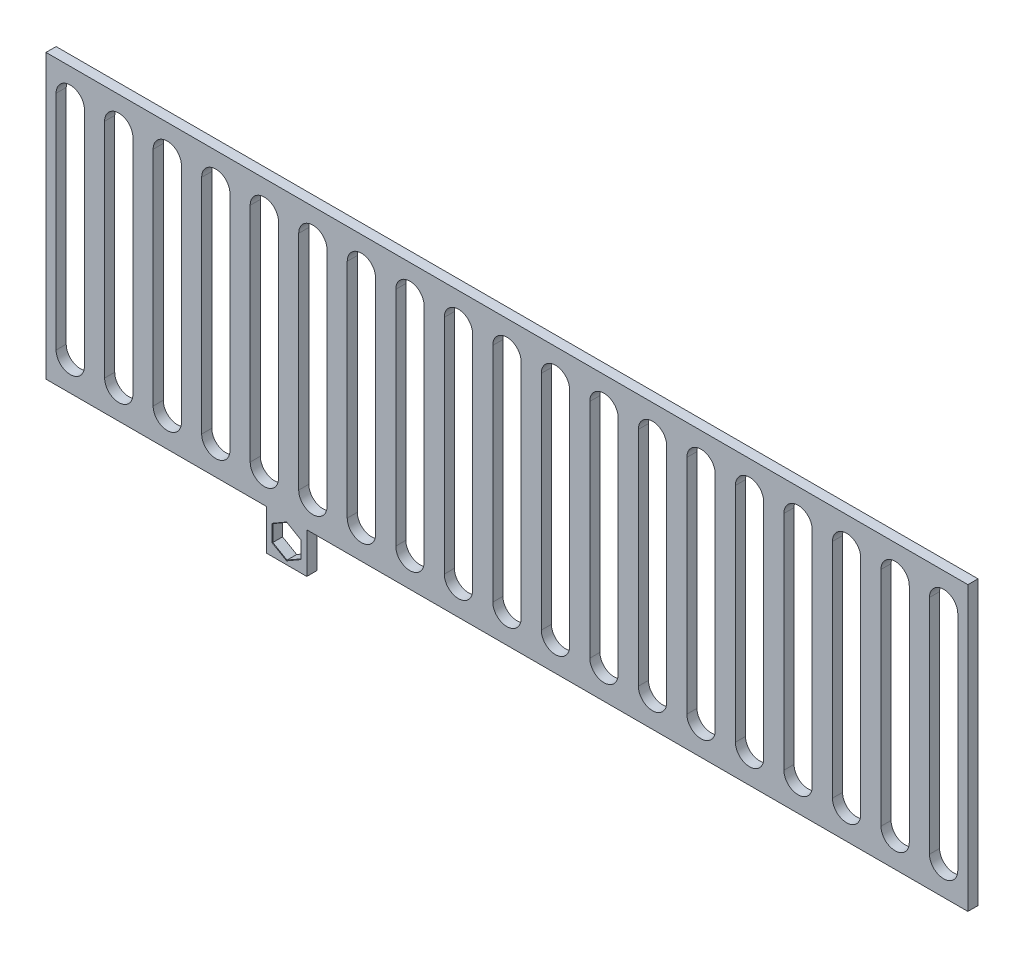
from build123d import *

# Parameters (mm, degrees)
BOSS_EXTRU_1_DEPTH = 2.5
CHANFREIN1_SIZE    = 0.1


with BuildPart() as part:
    # Esquisse1 → Boss.-Extru.1 (new body)
    with BuildSketch(Plane.XY):
        Polygon((-114, 35), (114, 35), (114, -35), (-49.5, -35), (-49.5, -45), (-59.5, -45), (-59.5, -35), (-114, -35), align=None)
        with BuildLine():
            Line((-111.5, -27.5), (-111.5, 27.5))
            ThreePointArc((-111.5, 27.5), (-108, 31), (-104.5, 27.5))
            Line((-104.5, 27.5), (-104.5, -27.5))
            ThreePointArc((-104.5, -27.5), (-108, -31), (-111.5, -27.5))
        make_face(mode=Mode.SUBTRACT)
        with BuildLine():
            Line((-92.5, -27.5), (-92.5, 27.5))
            ThreePointArc((-92.5, 27.5), (-96, 31), (-99.5, 27.5))
            Line((-99.5, 27.5), (-99.5, -27.5))
            ThreePointArc((-99.5, -27.5), (-96, -31), (-92.5, -27.5))
        make_face(mode=Mode.SUBTRACT)
        with BuildLine():
            Line((-80.5, -27.5), (-80.5, 27.5))
            ThreePointArc((-80.5, 27.5), (-84, 31), (-87.5, 27.5))
            Line((-87.5, 27.5), (-87.5, -27.5))
            ThreePointArc((-87.5, -27.5), (-84, -31), (-80.5, -27.5))
        make_face(mode=Mode.SUBTRACT)
        with BuildLine():
            Line((-68.5, -27.5), (-68.5, 27.5))
            ThreePointArc((-68.5, 27.5), (-72, 31), (-75.5, 27.5))
            Line((-75.5, 27.5), (-75.5, -27.5))
            ThreePointArc((-75.5, -27.5), (-72, -31), (-68.5, -27.5))
        make_face(mode=Mode.SUBTRACT)
        with BuildLine():
            Line((-56.5, -27.5), (-56.5, 27.5))
            ThreePointArc((-56.5, 27.5), (-60, 31), (-63.5, 27.5))
            Line((-63.5, 27.5), (-63.5, -27.5))
            ThreePointArc((-63.5, -27.5), (-60, -31), (-56.5, -27.5))
        make_face(mode=Mode.SUBTRACT)
        with BuildLine():
            Line((-44.5, -27.5), (-44.5, 27.5))
            ThreePointArc((-44.5, 27.5), (-48, 31), (-51.5, 27.5))
            Line((-51.5, 27.5), (-51.5, -27.5))
            ThreePointArc((-51.5, -27.5), (-48, -31), (-44.5, -27.5))
        make_face(mode=Mode.SUBTRACT)
        with BuildLine():
            Line((-32.5, -27.5), (-32.5, 27.5))
            ThreePointArc((-32.5, 27.5), (-36, 31), (-39.5, 27.5))
            Line((-39.5, 27.5), (-39.5, -27.5))
            ThreePointArc((-39.5, -27.5), (-36, -31), (-32.5, -27.5))
        make_face(mode=Mode.SUBTRACT)
        with BuildLine():
            Line((-20.5, -27.5), (-20.5, 27.5))
            ThreePointArc((-20.5, 27.5), (-24, 31), (-27.5, 27.5))
            Line((-27.5, 27.5), (-27.5, -27.5))
            ThreePointArc((-27.5, -27.5), (-24, -31), (-20.5, -27.5))
        make_face(mode=Mode.SUBTRACT)
        with BuildLine():
            Line((-8.5, -27.5), (-8.5, 27.5))
            ThreePointArc((-8.5, 27.5), (-12, 31), (-15.5, 27.5))
            Line((-15.5, 27.5), (-15.5, -27.5))
            ThreePointArc((-15.5, -27.5), (-12, -31), (-8.5, -27.5))
        make_face(mode=Mode.SUBTRACT)
        with BuildLine():
            Line((3.5, -27.5), (3.5, 27.5))
            ThreePointArc((3.5, 27.5), (0, 31), (-3.5, 27.5))
            Line((-3.5, 27.5), (-3.5, -27.5))
            ThreePointArc((-3.5, -27.5), (0, -31), (3.5, -27.5))
        make_face(mode=Mode.SUBTRACT)
        with BuildLine():
            Line((15.5, -27.5), (15.5, 27.5))
            ThreePointArc((15.5, 27.5), (12, 31), (8.5, 27.5))
            Line((8.5, 27.5), (8.5, -27.5))
            ThreePointArc((8.5, -27.5), (12, -31), (15.5, -27.5))
        make_face(mode=Mode.SUBTRACT)
        with BuildLine():
            Line((27.5, -27.5), (27.5, 27.5))
            ThreePointArc((27.5, 27.5), (24, 31), (20.5, 27.5))
            Line((20.5, 27.5), (20.5, -27.5))
            ThreePointArc((20.5, -27.5), (24, -31), (27.5, -27.5))
        make_face(mode=Mode.SUBTRACT)
        with BuildLine():
            Line((39.5, -27.5), (39.5, 27.5))
            ThreePointArc((39.5, 27.5), (36, 31), (32.5, 27.5))
            Line((32.5, 27.5), (32.5, -27.5))
            ThreePointArc((32.5, -27.5), (36, -31), (39.5, -27.5))
        make_face(mode=Mode.SUBTRACT)
        with BuildLine():
            Line((51.5, -27.5), (51.5, 27.5))
            ThreePointArc((51.5, 27.5), (48, 31), (44.5, 27.5))
            Line((44.5, 27.5), (44.5, -27.5))
            ThreePointArc((44.5, -27.5), (48, -31), (51.5, -27.5))
        make_face(mode=Mode.SUBTRACT)
        with BuildLine():
            Line((63.5, -27.5), (63.5, 27.5))
            ThreePointArc((63.5, 27.5), (60, 31), (56.5, 27.5))
            Line((56.5, 27.5), (56.5, -27.5))
            ThreePointArc((56.5, -27.5), (60, -31), (63.5, -27.5))
        make_face(mode=Mode.SUBTRACT)
        with BuildLine():
            Line((75.5, -27.5), (75.5, 27.5))
            ThreePointArc((75.5, 27.5), (72, 31), (68.5, 27.5))
            Line((68.5, 27.5), (68.5, -27.5))
            ThreePointArc((68.5, -27.5), (72, -31), (75.5, -27.5))
        make_face(mode=Mode.SUBTRACT)
        with BuildLine():
            Line((87.5, -27.5), (87.5, 27.5))
            ThreePointArc((87.5, 27.5), (84, 31), (80.5, 27.5))
            Line((80.5, 27.5), (80.5, -27.5))
            ThreePointArc((80.5, -27.5), (84, -31), (87.5, -27.5))
        make_face(mode=Mode.SUBTRACT)
        with BuildLine():
            Line((99.5, -27.5), (99.5, 27.5))
            ThreePointArc((99.5, 27.5), (96, 31), (92.5, 27.5))
            Line((92.5, 27.5), (92.5, -27.5))
            ThreePointArc((92.5, -27.5), (96, -31), (99.5, -27.5))
        make_face(mode=Mode.SUBTRACT)
        with BuildLine():
            Line((111.5, -27.5), (111.5, 27.5))
            ThreePointArc((111.5, 27.5), (108, 31), (104.5, 27.5))
            Line((104.5, 27.5), (104.5, -27.5))
            ThreePointArc((104.5, -27.5), (108, -31), (111.5, -27.5))
        make_face(mode=Mode.SUBTRACT)
        Polygon((-51, -42.020725942), (-51, -37.979274058), (-54.5, -35.958548116), (-58, -37.979274058), (-58, -42.020725942), (-54.5, -44.041451884), align=None, mode=Mode.SUBTRACT)
    extrude(amount=BOSS_EXTRU_1_DEPTH)

    # Chanfrein1
    chanfrein1_edges = [part.edges().sort_by_distance(p)[0] for p in [
        (-52.75, -43.031088913, 2.5),
        (-51, -40, 2.5),
        (-52.75, -36.968911087, 2.5),
        (-56.25, -36.968911087, 2.5),
        (-58, -40, 2.5),
        (-56.25, -43.031088913, 2.5),
    ]]
    chamfer(chanfrein1_edges, length=CHANFREIN1_SIZE)


solid = part.part
